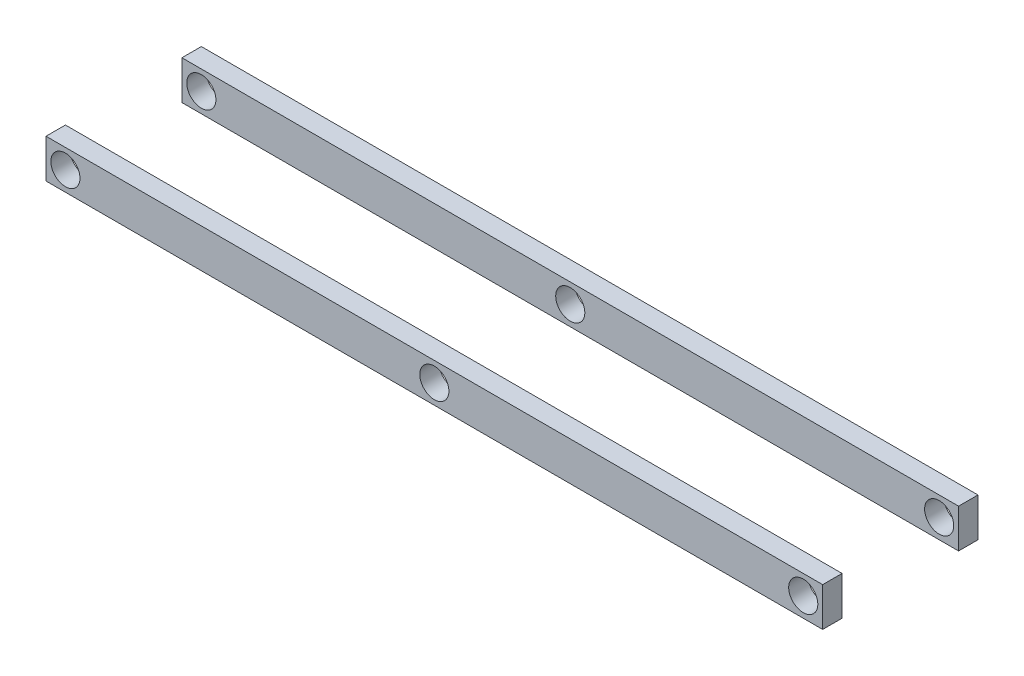
from build123d import *

# Parameters (mm, degrees)
SKETCH1_W           = 40
SKETCH1_H           = 8
BOSS_EXTRUDE1_DEPTH = 2
SKETCH2_W           = 40
SKETCH2_H           = 6
CUT_EXTRUDE1_DEPTH  = 2
SKETCH3_R           = 0.75
CUT_EXTRUDE2_DEPTH  = 41.841155713


with BuildPart() as part:
    # Sketch1 → Boss-Extrude1 (new body)
    with BuildSketch(Plane(origin=(0, 0, 0), x_dir=(1, 0, 0), z_dir=(0, 1, 0))):
        with Locations((20, 4)):
            Rectangle(SKETCH1_W, SKETCH1_H)
    extrude(amount=BOSS_EXTRUDE1_DEPTH)

    # Sketch2 → Cut-Extrude1 (cut)
    with BuildSketch(Plane(origin=(0, 2, 0), x_dir=(1, 0, 0), z_dir=(0, 1, 0))):
        with Locations((20, 4)):
            Rectangle(SKETCH2_W, SKETCH2_H)
    extrude(amount=-CUT_EXTRUDE1_DEPTH, mode=Mode.SUBTRACT)


with BuildPart() as cut_extrude1_piece_1:
    # of the separate pieces the step leaves, piece 1, a body of its own (cut_extrude1_pieces)
    add(part.part.solids().sort_by_distance((0, 0, -8))[0])


with BuildPart() as cut_extrude1_piece_2:
    # of the separate pieces the step leaves, piece 2, a body of its own (cut_extrude1_pieces)
    add(part.part.solids().sort_by_distance((0, 0, 0))[0])


with BuildPart() as cut_extrude2_tool:
    # Sketch3 → Cut-Extrude2 (new, through all)
    with BuildSketch(Plane.XY):
        with Locations((20, 1)):
            Circle(SKETCH3_R)
        with Locations((1, 1)):
            Circle(SKETCH3_R)
        with Locations((39, 1)):
            Circle(SKETCH3_R)
    extrude(amount=-CUT_EXTRUDE2_DEPTH)


with BuildPart() as cut_extrude1_piece_1_1:
    add(cut_extrude1_piece_1.part)

    # Cut-Extrude2: cut by cut_extrude2_tool
    add(cut_extrude2_tool.part, mode=Mode.SUBTRACT)


with BuildPart() as cut_extrude1_piece_2_1:
    add(cut_extrude1_piece_2.part)

    # Cut-Extrude2: cut by cut_extrude2_tool
    add(cut_extrude2_tool.part, mode=Mode.SUBTRACT)


solid = Compound([cut_extrude1_piece_1_1.part, cut_extrude1_piece_2_1.part])
